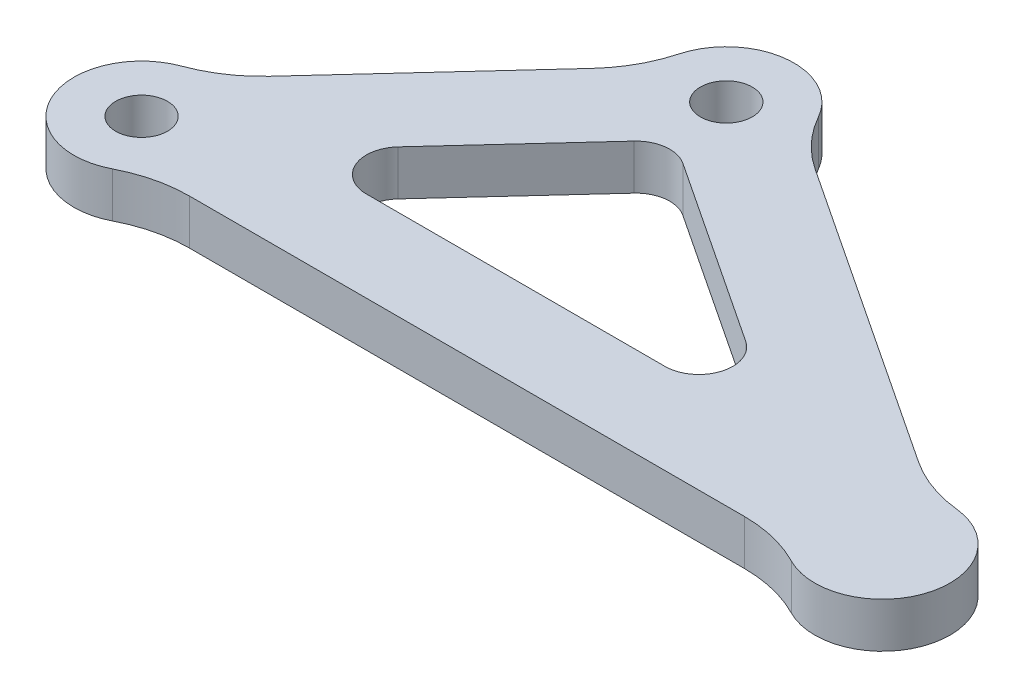
from build123d import *

# Parameters (mm, degrees)
SKETCH_1_R      = 1.15
EXTRUDE_1_DEPTH = 2
FILLET_1_R      = 6
FILLET_2_R      = 1.5


with BuildPart() as part:
    # Эскиз1 → Бобышка-Вытянуть1 (new body)
    with BuildSketch(Plane(origin=(0, 0, 0), x_dir=(1, 0, 0), z_dir=(0, 1, 0))):
        with BuildLine():
            Line((9.428338388, 13.219880501), (0.039848451, 2.999735338))
            ThreePointArc((0.039848451, 2.999735338), (-2.746686597, -1.206529212), (2.236067977, -2))
            Line((2.236067977, -2), (30.613932023, -2))
            ThreePointArc((30.613932023, -2), (35.722901746, -0.863965023), (32.087988444, 2.90160962))
            Line((32.087988444, 2.90160962), (15.382237716, 13.948474823))
            ThreePointArc((15.382237716, 13.948474823), (12.049527364, 16.491369305), (9.428338388, 13.219880501))
        make_face()
        with Locations(Location((0, 0, 0), (0, 0, 270))):
            Circle(SKETCH_1_R, mode=Mode.SUBTRACT)
        with Locations(Location((12.413926941, 13.513582719, 0), (0, 0, 270))):
            Circle(SKETCH_1_R, mode=Mode.SUBTRACT)
        Polygon((4.55303787, 2), (12.733176086, 10.904754713), (26.199495246, 2), align=None, mode=Mode.SUBTRACT)
    extrude(amount=EXTRUDE_1_DEPTH)

    # Скругление1
    fillet_1_edges = [part.edges().sort_by_distance(p)[0] for p in [
        (2.236067977, 1, 2),
        (0.039848451, 1, -2.999735338),
        (9.428338388, 1, -13.219880501),
        (15.382237716, 1, -13.948474823),
        (32.087988444, 1, -2.90160962),
        (30.613932023, 1, 2),
    ]]
    fillet(fillet_1_edges, radius=FILLET_1_R)

    # Скругление2
    fillet_2_edges = [part.edges().sort_by_distance(p)[0] for p in [
        (26.199495246, 1, -2),
        (12.733176086, 1, -10.904754713),
        (4.55303787, 1, -2),
    ]]
    fillet(fillet_2_edges, radius=FILLET_2_R)


solid = part.part
